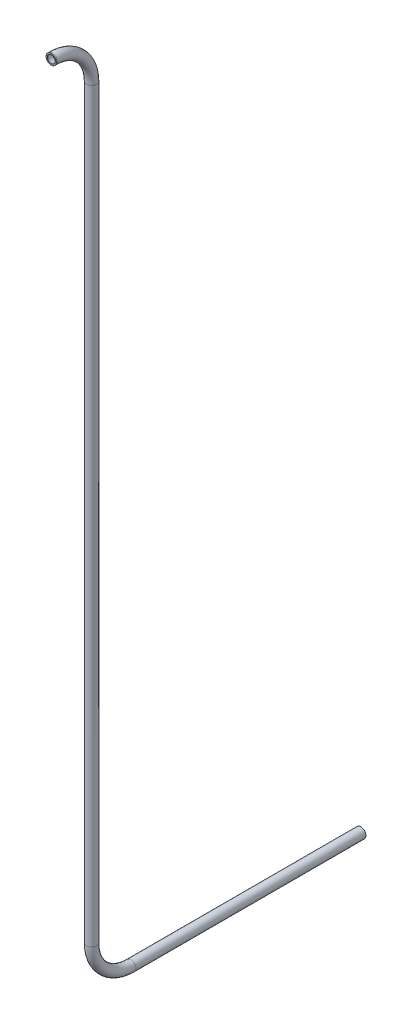
from build123d import *

# Parameters (mm, degrees)
SWEEP_THIN1_PROFILE_R   = 0.9144
SWEEP_THIN1_PROFILE_R_2 = 0.6858


with BuildPart() as part:
    # Sweep-Thin1: sweep along a curve in space
    with BuildLine() as sweep_thin1_path:
        Line((0, 0, 0), (0, 0, -0.2))
        ThreePointArc((0, 0, -0.2), (0, -2.050252532, -5.149747468), (0, -7, -7.2))
        Line((0, -7, -7.2), (0, -140, -7.2))
        ThreePointArc((0, -140, -7.2), (0, -144.949747468, -9.250252532), (0, -147, -14.2))
        Line((0, -147, -14.2), (0, -147, -55.2))
    # Sweep-Thin1 profile (on start of the path) → Sweep-Thin1 (sweep)
    with BuildSketch(Plane(origin=(0, 0, 0), x_dir=(-1, 0, 0), z_dir=(0, 0, -1))):
        Circle(SWEEP_THIN1_PROFILE_R)
        Circle(SWEEP_THIN1_PROFILE_R_2, mode=Mode.SUBTRACT)
    sweep(path=sweep_thin1_path.line)


solid = part.part
